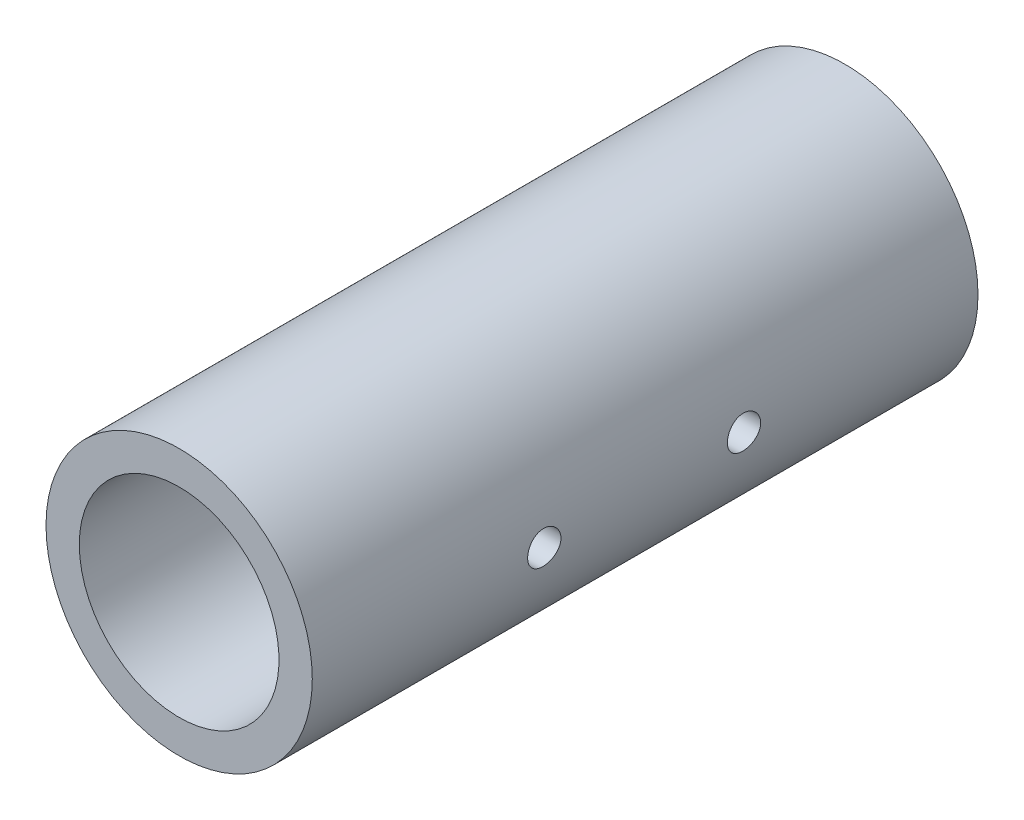
from build123d import *

# Parameters (mm, degrees)
SKETCH1_R               = 20
BOSS_EXTRUDE1_DEPTH     = 100
SKETCH2_R               = 15
CUT_EXTRUDE1_DEPTH      = 100
CUT_EXTRUDE5_DEPTH      = 104.923048454
CUT_EXTRUDE5_DEPTH_BACK = 104.923048454
SKETCH6_R               = 2.5


with BuildPart() as part:
    # Sketch1 → Boss-Extrude1 (new body)
    with BuildSketch(Plane.XY):
        Circle(SKETCH1_R)
    extrude(amount=BOSS_EXTRUDE1_DEPTH)

    # Sketch2 → Cut-Extrude1 (cut)
    with BuildSketch(Plane(origin=(0, 0, 0), x_dir=(-1, 0, 0), z_dir=(0, 0, -1))):
        Circle(SKETCH2_R)
    extrude(amount=-CUT_EXTRUDE1_DEPTH, mode=Mode.SUBTRACT)

    # Sketch6 → Cut-Extrude5 (cut, two sides: drawn at the far end of the back side and taken through both)
    with BuildSketch(Plane(origin=(0, 0, 0), x_dir=(0, 0, -1), z_dir=(1, 0, 0)).offset(-CUT_EXTRUDE5_DEPTH_BACK)):
        with Locations((-65.143240637, -0.390136297)):
            Circle(SKETCH6_R)
        with Locations((-35.143240637, -0.390136297)):
            Circle(SKETCH6_R)
    extrude(amount=CUT_EXTRUDE5_DEPTH + CUT_EXTRUDE5_DEPTH_BACK, mode=Mode.SUBTRACT)


solid = part.part
